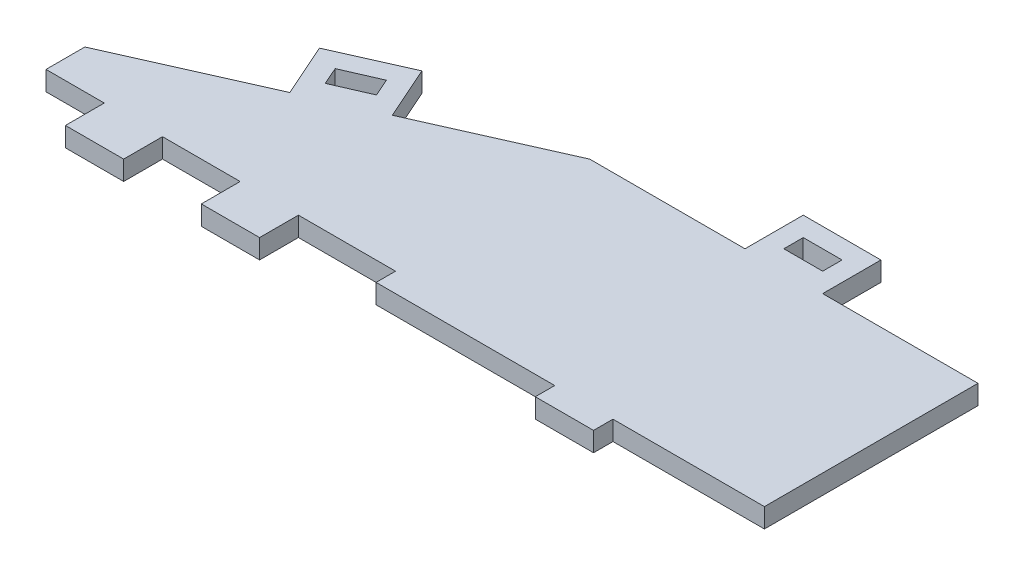
from build123d import *

# Parameters (mm, degrees)
SKETCH1_W           = 10
SKETCH1_H           = 5
BOSS_EXTRUDE1_DEPTH = 5


with BuildPart() as part:
    # Sketch1 → Boss-Extrude1 (new body)
    with BuildSketch(Plane(origin=(0, 0, 0), x_dir=(1, 0, 0), z_dir=(0, 1, 0))):
        Polygon((0, 0), (15, 0), (15, -10), (30, -10), (30, 0), (50, 0), (50, -10), (65, -10), (65, 0), (90, 0), (90, -5), (136, -5), (136, -10), (151, -10), (151, -5), (190, -5), (190, 50), (150, 50), (150, 65), (130, 65), (130, 50), (90, 50), (54.828692917, 34.368307963), (48.736615926, 48.075481193), (30.460384954, 39.952711871), (36.552461945, 26.245538642), (0, 10), align=None)
        Polygon((39.061482867, 32.832359245), (37.060135027, 37.414346459), (46.224109455, 41.417042137), (48.254801785, 36.847984394), align=None, mode=Mode.SUBTRACT)
        with Locations((140, 57.5)):
            Rectangle(SKETCH1_W, SKETCH1_H, mode=Mode.SUBTRACT)
    extrude(amount=BOSS_EXTRUDE1_DEPTH)


solid = part.part
